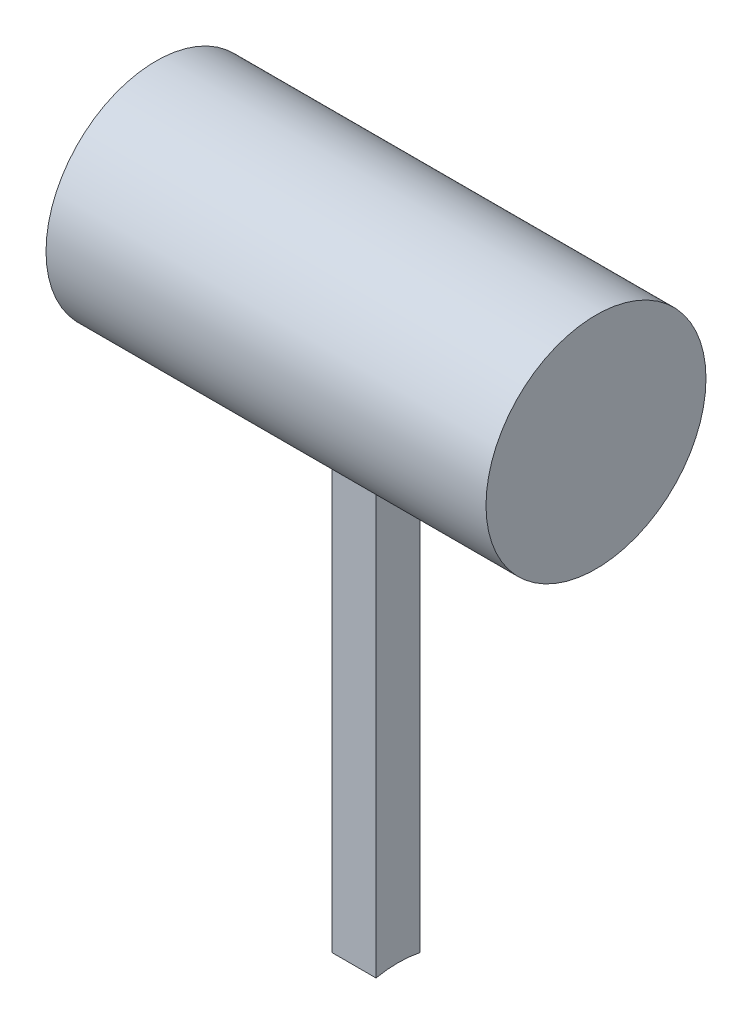
from build123d import *

# Parameters (mm, degrees)
SKETCH1_R           = 5
BOSS_EXTRUDE1_DEPTH = 10
SKETCH2_W           = 2
SKETCH2_H           = 30
BOSS_EXTRUDE2_DEPTH = 1
SKETCH3_R           = 5
CUT_EXTRUDE1_DEPTH  = 33.341923258


with BuildPart() as part:
    # Sketch1 → Boss-Extrude1 (new, symmetric)
    with BuildSketch(Plane(origin=(0, 0, 0), x_dir=(0, 0, -1), z_dir=(1, 0, 0))):
        Circle(SKETCH1_R)
    extrude(amount=BOSS_EXTRUDE1_DEPTH, both=True)

    # Sketch2 → Boss-Extrude2 (add, symmetric)
    with BuildSketch(Plane.XY):
        with Locations((0, -15)):
            Rectangle(SKETCH2_W, SKETCH2_H)
    extrude(amount=BOSS_EXTRUDE2_DEPTH, both=True)

    # Sketch3 → Cut-Extrude1 (cut, through all)
    with BuildSketch(Plane(origin=(1, 0, 0), x_dir=(0, 0, -1), z_dir=(1, 0, 0))):
        with Locations((0, -30)):
            Circle(SKETCH3_R)
    extrude(amount=-CUT_EXTRUDE1_DEPTH, mode=Mode.SUBTRACT)


solid = part.part
